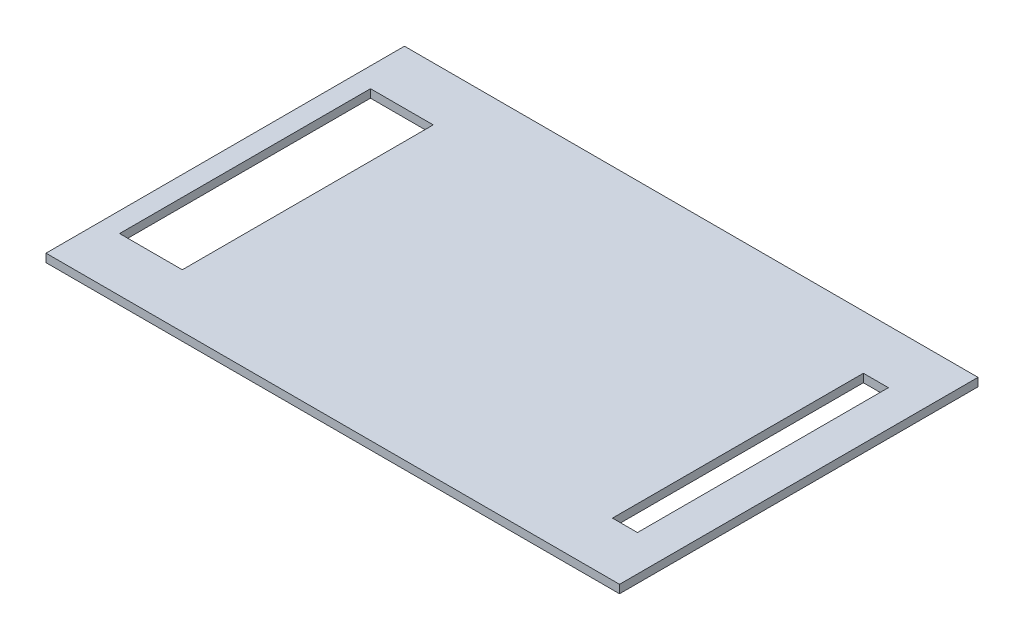
from build123d import *

# Parameters (mm, degrees)
SKETCH1_W           = 406.4
SKETCH1_H           = 254
SKETCH1_W_2         = 44.45
SKETCH1_H_2         = 177.8
SKETCH1_W_3         = 17.7165
BOSS_EXTRUDE1_DEPTH = 5.842


with BuildPart() as part:
    # Sketch1 → Boss-Extrude1 (new body)
    with BuildSketch(Plane(origin=(0, 0, 0), x_dir=(1, 0, 0), z_dir=(0, 1, 0))):
        with Locations((-203.2, 127)):
            Rectangle(SKETCH1_W, SKETCH1_H)
        with Locations((-370.1415, 127)):
            Rectangle(SKETCH1_W_2, SKETCH1_H_2, mode=Mode.SUBTRACT)
        with Locations((-34.25825, 127)):
            Rectangle(SKETCH1_W_3, SKETCH1_H_2, mode=Mode.SUBTRACT)
    extrude(amount=BOSS_EXTRUDE1_DEPTH)


solid = part.part
